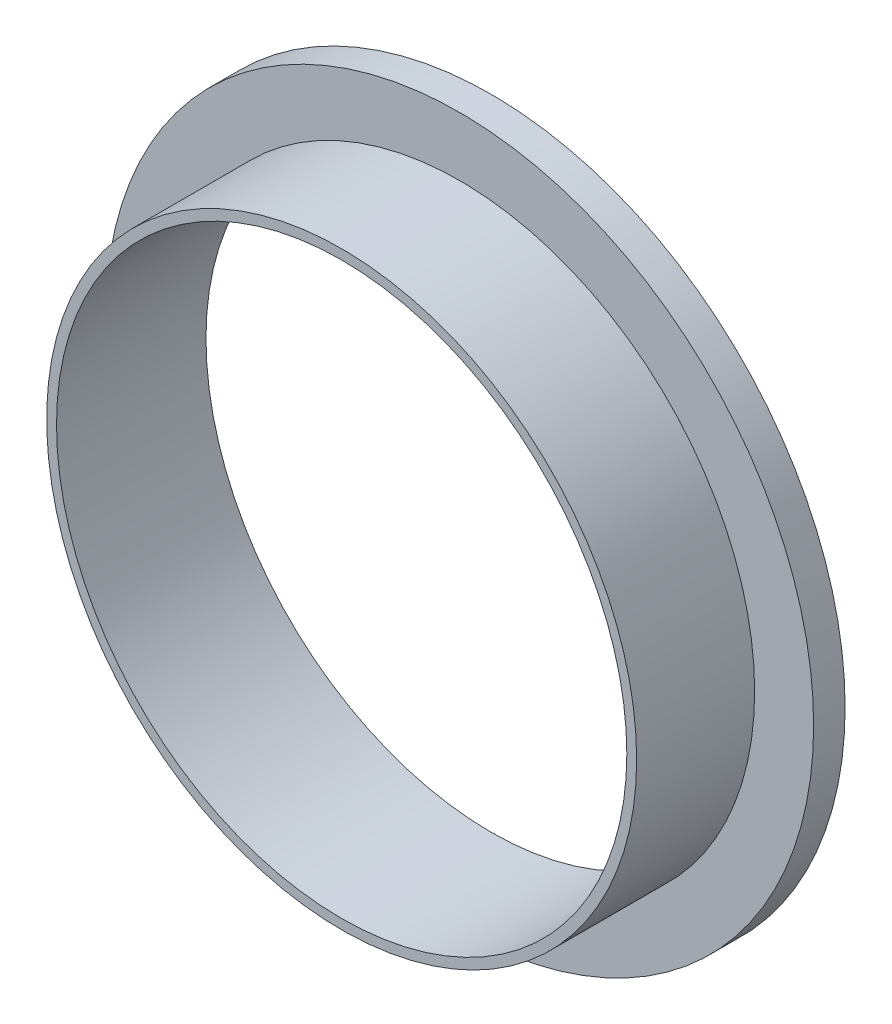
from build123d import *

# Parameters (mm, degrees)
SKETCH_1_R      = 90
SKETCH_1_R_2    = 72.5
EXTRUDE_1_DEPTH = 8
SKETCH_2_R      = 75
SKETCH_2_R_2    = 72.5
EXTRUDE_2_DEPTH = 30


with BuildPart() as part:
    # 草图1 → 凸台-拉伸1 (new body)
    with BuildSketch(Plane.XY):
        Circle(SKETCH_1_R)
        Circle(SKETCH_1_R_2, mode=Mode.SUBTRACT)
    extrude(amount=EXTRUDE_1_DEPTH)

    # 草图2 → 凸台-拉伸2 (add)
    with BuildSketch(Plane.XY.offset(8)):
        Circle(SKETCH_2_R)
        Circle(SKETCH_2_R_2, mode=Mode.SUBTRACT)
    extrude(amount=EXTRUDE_2_DEPTH)


solid = part.part
